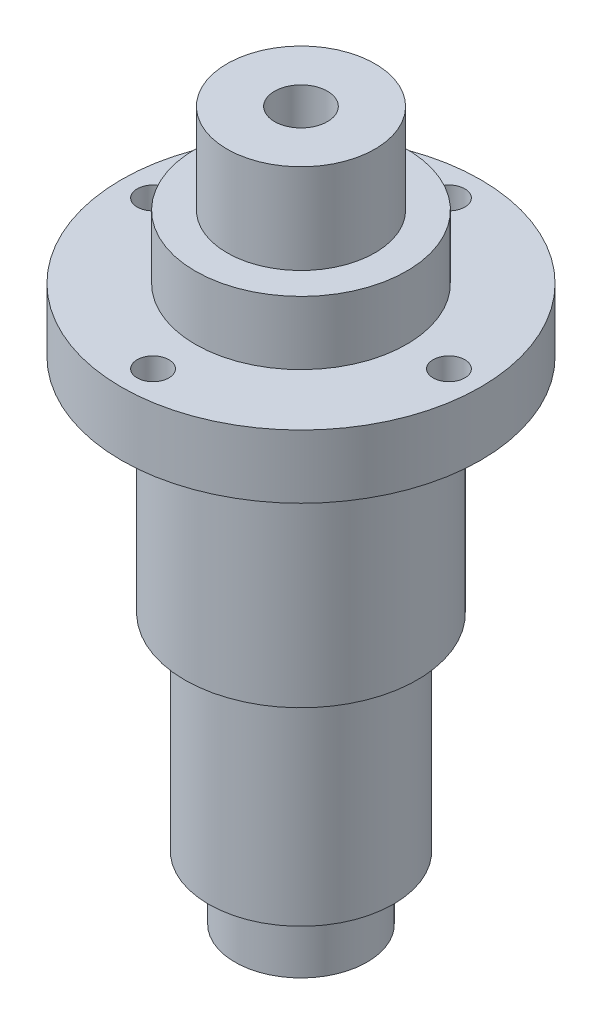
from build123d import *

# Parameters (mm, degrees)
SKETCH_1_R               = 20
EXTRUDE_1_DEPTH          = 12
SKETCH_3_R               = 34
EXTRUDE_2_DEPTH          = 12
SKETCH_4_R               = 22
EXTRUDE_3_DEPTH          = 42
SKETCH_5_R               = 17.5
EXTRUDE_5_DEPTH          = 39
SKETCH_6_R               = 12.5
EXTRUDE_6_DEPTH          = 12
SKETCH_8_R               = 16
SKETCH_8_R_2             = 10
EXTRUDE_7_DEPTH          = 18
SKETCH_11_R              = 3
CUT_EXTRUDE_9_DEPTH      = 12
PATTERN_CIRCULAR_1_COUNT = 4
SKETCH_12_R              = 14
EXTRUDE_8_DEPTH          = 17
SKETCH_14_R              = 5
CUT_EXTRUDE_10_DEPTH     = 15


with BuildPart() as part:
    # 草图1 → 凸台-拉伸1 (new body)
    with BuildSketch(Plane(origin=(0, 0, 0), x_dir=(1, 0, 0), z_dir=(0, 1, 0))):
        with Locations(Location((0, 0, 0), (0, 0, 270))):
            Circle(SKETCH_1_R)
    extrude(amount=EXTRUDE_1_DEPTH)

    # 草图3 → 凸台-拉伸2 (add)
    with BuildSketch(Plane.XZ):
        with Locations(Location((0, 0, 0), (0, 0, 270))):
            Circle(SKETCH_3_R)
    extrude(amount=EXTRUDE_2_DEPTH)

    # 草图4 → 凸台-拉伸3 (add)
    with BuildSketch(Plane.XZ.offset(12)):
        with Locations(Location((0, 0, 0), (0, 0, 90))):
            Circle(SKETCH_4_R)
    extrude(amount=EXTRUDE_3_DEPTH)

    # 草图5 → 凸台-拉伸5 (add)
    with BuildSketch(Plane.XZ.offset(54)):
        with Locations(Location((0, 0, 0), (0, 0, 270))):
            Circle(SKETCH_5_R)
    extrude(amount=EXTRUDE_5_DEPTH)

    # 草图6 → 凸台-拉伸6 (add)
    with BuildSketch(Plane.XZ.offset(93)):
        with Locations(Location((0, 0, 0), (0, 0, 270))):
            Circle(SKETCH_6_R)
    extrude(amount=EXTRUDE_6_DEPTH)

    # 草图8 → 凸台-拉伸7 (add)
    with BuildSketch(Plane.XZ.offset(12)):
        Circle(SKETCH_8_R)
        Circle(SKETCH_8_R_2, mode=Mode.SUBTRACT)
    extrude(amount=EXTRUDE_7_DEPTH)

    # 草图11 → 切除-拉伸9 (cut)
    with BuildSketch(Plane.XZ.offset(12)):
        with Locations(Location((0, 28, 0), (0, 0, 270))):
            Circle(SKETCH_11_R)
    cut_extrude_9 = extrude(amount=-CUT_EXTRUDE_9_DEPTH, mode=Mode.SUBTRACT)

    # 阵列(圆周)1: 切除-拉伸9 ×4 about axis
    pattern_circular_1_axis = Axis((0, 0, 0), (0, 1, 0))
    for i in range(1, PATTERN_CIRCULAR_1_COUNT):
        add(cut_extrude_9.rotate(pattern_circular_1_axis, i * 360 / PATTERN_CIRCULAR_1_COUNT), mode=Mode.SUBTRACT)

    # 草图12 → 凸台-拉伸8 (add)
    with BuildSketch(Plane(origin=(0, 12, 0), x_dir=(1, 0, 0), z_dir=(0, 1, 0))):
        with Locations(Location((0, 0, 0), (0, 0, 270))):
            Circle(SKETCH_12_R)
    extrude(amount=EXTRUDE_8_DEPTH)

    # 草图14 → 切除-拉伸10 (cut)
    with BuildSketch(Plane(origin=(0, 29, 0), x_dir=(1, 0, 0), z_dir=(0, 1, 0))):
        with Locations(Location((0, 0, 0), (0, 0, 270))):
            Circle(SKETCH_14_R)
    extrude(amount=-CUT_EXTRUDE_10_DEPTH, mode=Mode.SUBTRACT)


solid = part.part
